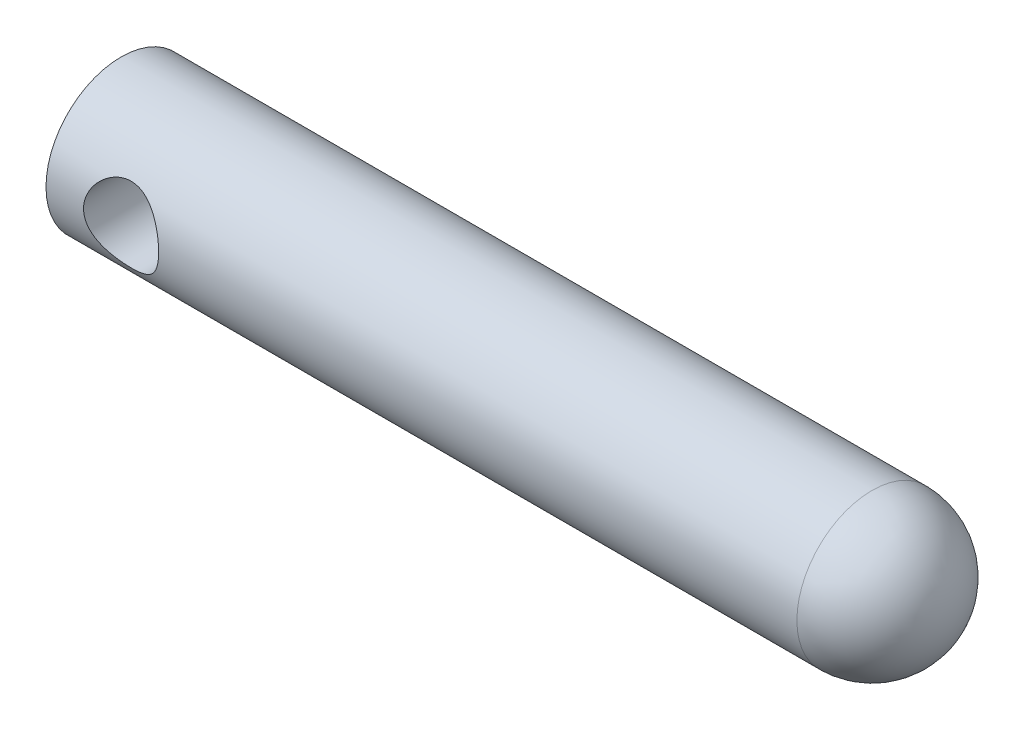
from build123d import *

# Parameters (mm, degrees)
SKETCH1_R           = 2
BOSS_EXTRUDE1_DEPTH = 22
SKETCH2_R           = 1
CUT_EXTRUDE1_DEPTH  = 4
FILLET2_R           = 2


with BuildPart() as part:
    # Sketch1 → Boss-Extrude1 (new body)
    with BuildSketch(Plane(origin=(0, 0, 0), x_dir=(0, 0, -1), z_dir=(1, 0, 0))):
        Circle(SKETCH1_R)
    extrude(amount=BOSS_EXTRUDE1_DEPTH)

    # Sketch2 → Cut-Extrude1 (cut)
    with BuildSketch(Plane.XY.offset(2)):
        with Locations((2, 0)):
            Circle(SKETCH2_R)
    extrude(amount=-CUT_EXTRUDE1_DEPTH, mode=Mode.SUBTRACT)

    # Fillet2
    fillet2_edges = [part.edges().sort_by_distance(p)[0] for p in [
        (22, 0, 2),
    ]]
    fillet(fillet2_edges, radius=FILLET2_R)


solid = part.part
